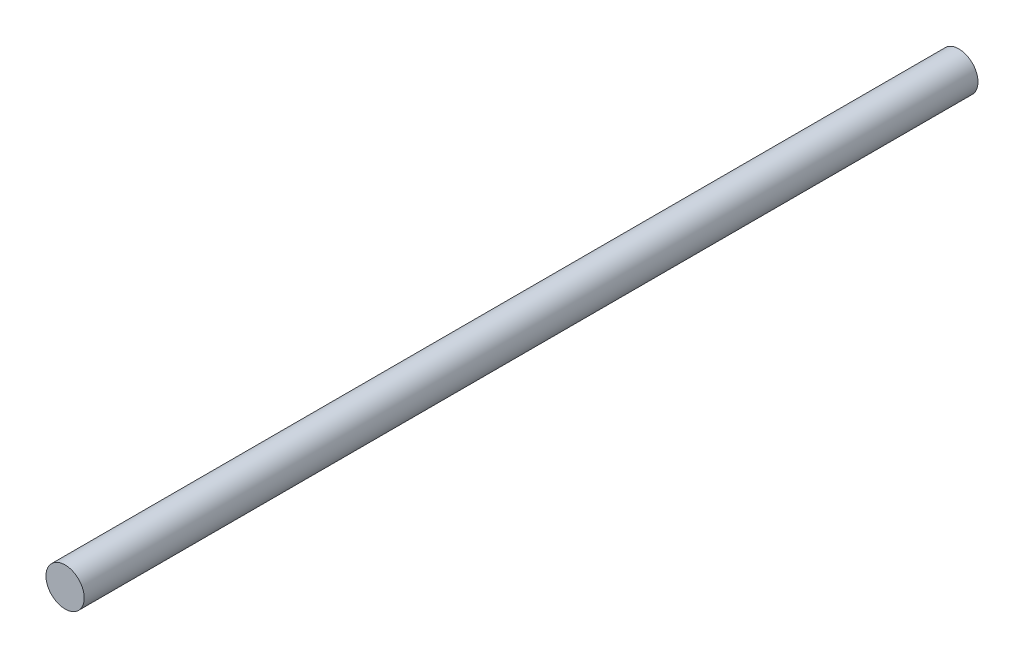
from build123d import *

# Parameters (mm, degrees)
SKETCH_1_R      = 10.7
EXTRUDE_2_DEPTH = 500


with BuildPart() as part:
    # Эскиз1 → Бобышка-Вытянуть2 (new body)
    with BuildSketch(Plane.XY):
        Circle(SKETCH_1_R)
    extrude(amount=EXTRUDE_2_DEPTH)


solid = part.part
